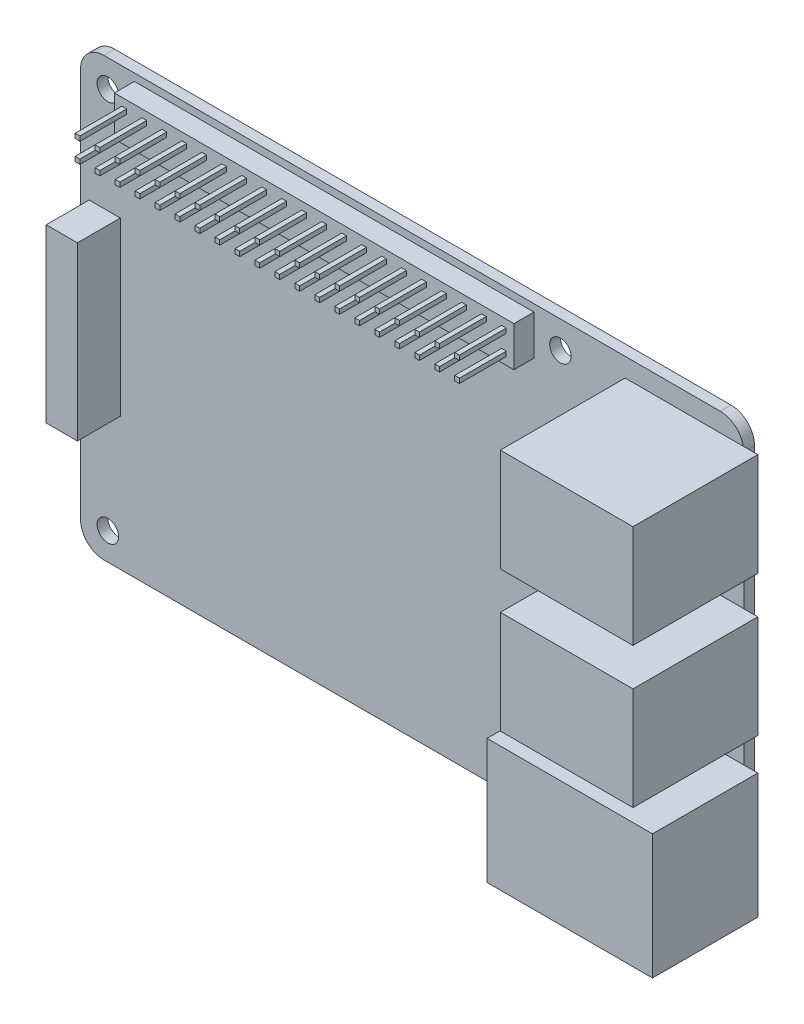
from build123d import *

# Parameters (mm, degrees)
ESQUISSE1_R        = 1.375
BOSS_EXTRU_1_DEPTH = 1.38
ESQUISSE2_W        = 51.2
ESQUISSE2_H        = 5.12
BOSS_EXTRU_2_DEPTH = 2.56
ESQUISSE3_W        = 0.6
ESQUISSE3_H        = 0.6
BOSS_EXTRU_3_DEPTH = 6
ESQUISSE4_W        = 4
ESQUISSE4_H        = 22
BOSS_EXTRU_4_DEPTH = 5.5
ESQUISSE5_W        = 17
ESQUISSE5_H        = 13.18
BOSS_EXTRU_5_DEPTH = 16
ESQUISSE6_W        = 21.2
ESQUISSE6_H        = 16
BOSS_EXTRU_6_DEPTH = 13.5


with BuildPart() as part:
    # Esquisse1 → Boss.-Extru.1 (new body)
    with BuildSketch(Plane.XY):
        with BuildLine():
            Line((-39.5, 28), (39.5, 28))
            ThreePointArc((39.5, 28), (41.621320344, 27.121320344), (42.5, 25))
            Line((42.5, 25), (42.5, -25))
            ThreePointArc((42.5, -25), (41.621320344, -27.121320344), (39.5, -28))
            Line((39.5, -28), (-39.5, -28))
            ThreePointArc((-39.5, -28), (-41.621320344, -27.121320344), (-42.5, -25))
            Line((-42.5, -25), (-42.5, 25))
            ThreePointArc((-42.5, 25), (-41.621320344, 27.121320344), (-39.5, 28))
        make_face()
        with Locations((-39, 24.5)):
            Circle(ESQUISSE1_R, mode=Mode.SUBTRACT)
        with Locations((-39, -24.5)):
            Circle(ESQUISSE1_R, mode=Mode.SUBTRACT)
        with Locations((19, -24.5)):
            Circle(ESQUISSE1_R, mode=Mode.SUBTRACT)
        with Locations((19, 24.5)):
            Circle(ESQUISSE1_R, mode=Mode.SUBTRACT)
    extrude(amount=BOSS_EXTRU_1_DEPTH)

    # Esquisse2 → Boss.-Extru.2 (add)
    with BuildSketch(Plane.XY.offset(1.38)):
        with Locations((-10, 24.5)):
            Rectangle(ESQUISSE2_W, ESQUISSE2_H)
    extrude(amount=BOSS_EXTRU_2_DEPTH)

    # Esquisse3 → Boss.-Extru.3 (add)
    with BuildSketch(Plane.XY.offset(3.94)):
        with Locations((-34.32, 25.78)):
            Rectangle(ESQUISSE3_W, ESQUISSE3_H)
        with Locations((-31.76, 25.78)):
            Rectangle(ESQUISSE3_W, ESQUISSE3_H)
        with Locations((-29.2, 25.78)):
            Rectangle(ESQUISSE3_W, ESQUISSE3_H)
        with Locations((-26.64, 25.78)):
            Rectangle(ESQUISSE3_W, ESQUISSE3_H)
        with Locations((-24.08, 25.78)):
            Rectangle(ESQUISSE3_W, ESQUISSE3_H)
        with Locations((-21.52, 25.78)):
            Rectangle(ESQUISSE3_W, ESQUISSE3_H)
        with Locations((-18.96, 25.78)):
            Rectangle(ESQUISSE3_W, ESQUISSE3_H)
        with Locations((-16.4, 25.78)):
            Rectangle(ESQUISSE3_W, ESQUISSE3_H)
        with Locations((-13.84, 25.78)):
            Rectangle(ESQUISSE3_W, ESQUISSE3_H)
        with Locations((-11.28, 25.78)):
            Rectangle(ESQUISSE3_W, ESQUISSE3_H)
        with Locations((-8.72, 25.78)):
            Rectangle(ESQUISSE3_W, ESQUISSE3_H)
        with Locations((-6.16, 25.78)):
            Rectangle(ESQUISSE3_W, ESQUISSE3_H)
        with Locations((-3.6, 25.78)):
            Rectangle(ESQUISSE3_W, ESQUISSE3_H)
        with Locations((-1.04, 25.78)):
            Rectangle(ESQUISSE3_W, ESQUISSE3_H)
        with Locations((1.52, 25.78)):
            Rectangle(ESQUISSE3_W, ESQUISSE3_H)
        with Locations((4.08, 25.78)):
            Rectangle(ESQUISSE3_W, ESQUISSE3_H)
        with Locations((6.64, 25.78)):
            Rectangle(ESQUISSE3_W, ESQUISSE3_H)
        with Locations((9.2, 25.78)):
            Rectangle(ESQUISSE3_W, ESQUISSE3_H)
        with Locations((11.76, 25.78)):
            Rectangle(ESQUISSE3_W, ESQUISSE3_H)
        with Locations((14.32, 25.78)):
            Rectangle(ESQUISSE3_W, ESQUISSE3_H)
        with Locations((-31.76, 23.22)):
            Rectangle(ESQUISSE3_W, ESQUISSE3_H)
        with Locations((-29.2, 23.22)):
            Rectangle(ESQUISSE3_W, ESQUISSE3_H)
        with Locations((-26.64, 23.22)):
            Rectangle(ESQUISSE3_W, ESQUISSE3_H)
        with Locations((-24.08, 23.22)):
            Rectangle(ESQUISSE3_W, ESQUISSE3_H)
        with Locations((-21.52, 23.22)):
            Rectangle(ESQUISSE3_W, ESQUISSE3_H)
        with Locations((-18.96, 23.22)):
            Rectangle(ESQUISSE3_W, ESQUISSE3_H)
        with Locations((-16.4, 23.22)):
            Rectangle(ESQUISSE3_W, ESQUISSE3_H)
        with Locations((-13.84, 23.22)):
            Rectangle(ESQUISSE3_W, ESQUISSE3_H)
        with Locations((-11.28, 23.22)):
            Rectangle(ESQUISSE3_W, ESQUISSE3_H)
        with Locations((-8.72, 23.22)):
            Rectangle(ESQUISSE3_W, ESQUISSE3_H)
        with Locations((-6.16, 23.22)):
            Rectangle(ESQUISSE3_W, ESQUISSE3_H)
        with Locations((-3.6, 23.22)):
            Rectangle(ESQUISSE3_W, ESQUISSE3_H)
        with Locations((-1.04, 23.22)):
            Rectangle(ESQUISSE3_W, ESQUISSE3_H)
        with Locations((1.52, 23.22)):
            Rectangle(ESQUISSE3_W, ESQUISSE3_H)
        with Locations((4.08, 23.22)):
            Rectangle(ESQUISSE3_W, ESQUISSE3_H)
        with Locations((6.64, 23.22)):
            Rectangle(ESQUISSE3_W, ESQUISSE3_H)
        with Locations((9.2, 23.22)):
            Rectangle(ESQUISSE3_W, ESQUISSE3_H)
        with Locations((11.76, 23.22)):
            Rectangle(ESQUISSE3_W, ESQUISSE3_H)
        with Locations((14.32, 23.22)):
            Rectangle(ESQUISSE3_W, ESQUISSE3_H)
        with Locations((-34.32, 23.22)):
            Rectangle(ESQUISSE3_W, ESQUISSE3_H)
    extrude(amount=BOSS_EXTRU_3_DEPTH)

    # Esquisse4 → Boss.-Extru.4 (add)
    with BuildSketch(Plane.XY.offset(1.38)):
        with Locations((-39.4, 0)):
            Rectangle(ESQUISSE4_W, ESQUISSE4_H)
    extrude(amount=BOSS_EXTRU_4_DEPTH)

    # Esquisse5 → Boss.-Extru.5 (add)
    with BuildSketch(Plane.XY.offset(1.38)):
        with Locations((35.8, 19)):
            Rectangle(ESQUISSE5_W, ESQUISSE5_H)
        with Locations((35.8, 1)):
            Rectangle(ESQUISSE5_W, ESQUISSE5_H)
    extrude(amount=BOSS_EXTRU_5_DEPTH)

    # Esquisse6 → Boss.-Extru.6 (add)
    with BuildSketch(Plane.XY.offset(1.38)):
        with Locations((33.7, -17.75)):
            Rectangle(ESQUISSE6_W, ESQUISSE6_H)
    extrude(amount=BOSS_EXTRU_6_DEPTH)


solid = part.part
